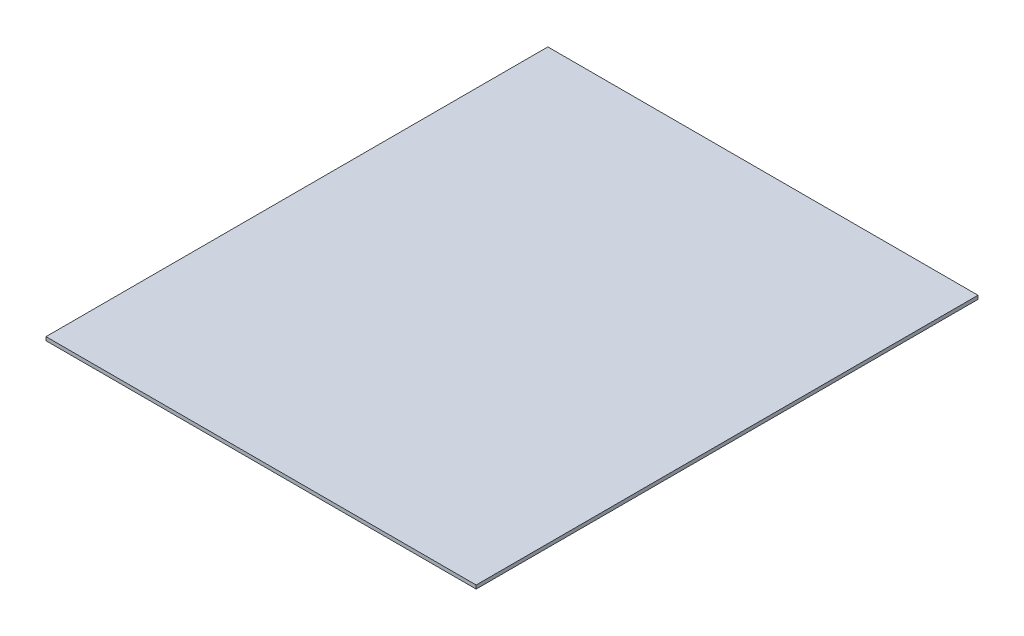
from build123d import *

# Parameters (mm, degrees)
SKETCH1_W           = 240
SKETCH1_H           = 280
BOSS_EXTRUDE1_DEPTH = 2


with BuildPart() as part:
    # Sketch1 → Boss-Extrude1 (new body)
    with BuildSketch(Plane(origin=(0, 0, 0), x_dir=(1, 0, 0), z_dir=(0, 1, 0))):
        with Locations((120, 140)):
            Rectangle(SKETCH1_W, SKETCH1_H)
    extrude(amount=BOSS_EXTRUDE1_DEPTH)


solid = part.part
